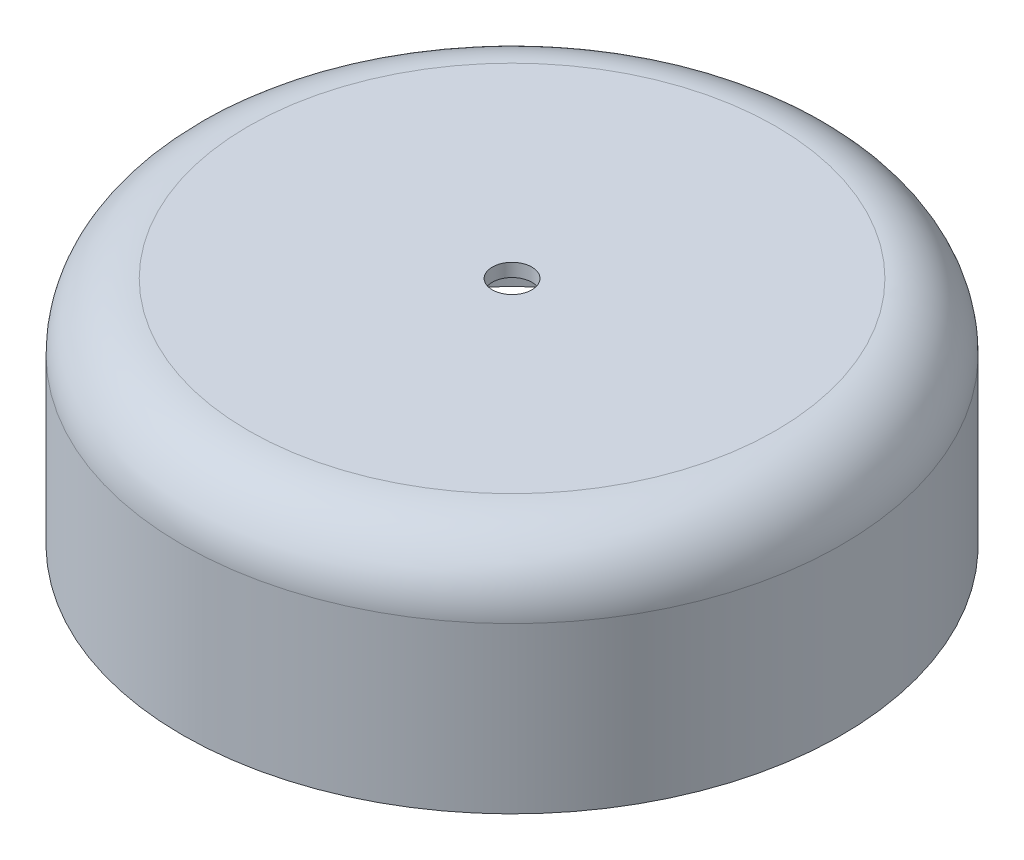
from build123d import *

# Parameters (mm, degrees)
SKETCH1_R           = 50
BOSS_EXTRUDE1_DEPTH = 35
FILLET1_R           = 10
SHELL1_T            = -2
SKETCH2_W           = 12
SKETCH2_H           = 4.5
BOSS_EXTRUDE2_DEPTH = 6.5
SKETCH3_R           = 3
CUT_EXTRUDE1_DEPTH  = 6.5


with BuildPart() as part:
    # Sketch1 → Boss-Extrude1 (new body)
    with BuildSketch(Plane(origin=(0, 0, 0), x_dir=(1, 0, 0), z_dir=(0, 1, 0))):
        with Locations(Location((0, 0, 0), (0, 0, 270))):
            Circle(SKETCH1_R)
    extrude(amount=BOSS_EXTRUDE1_DEPTH)

    # Fillet1
    fillet1_edges = [part.edges().sort_by_distance(p)[0] for p in [
        (0, 35, -50),
    ]]
    fillet(fillet1_edges, radius=FILLET1_R)

    # Shell1
    shell1_openings = [part.faces().sort_by_distance(p)[0] for p in [
        (0, 0, 0),
    ]]
    offset(amount=SHELL1_T, openings=shell1_openings, kind=Kind.INTERSECTION)

    # Sketch2 → Boss-Extrude2 (add)
    with BuildSketch(Plane.XZ.offset(-33)):
        with Locations((0, 8.25)):
            Rectangle(SKETCH2_W, SKETCH2_H)
        with Locations((0, -19.25)):
            Rectangle(SKETCH2_W, SKETCH2_H)
    extrude(amount=BOSS_EXTRUDE2_DEPTH)

    # Sketch3 → Cut-Extrude1 (cut)
    with BuildSketch(Plane(origin=(0, 35, 0), x_dir=(1, 0, 0), z_dir=(0, 1, 0))):
        with Locations(Location((0, 0, 0), (0, 0, 270))):
            Circle(SKETCH3_R)
    extrude(amount=-CUT_EXTRUDE1_DEPTH, mode=Mode.SUBTRACT)


solid = part.part
